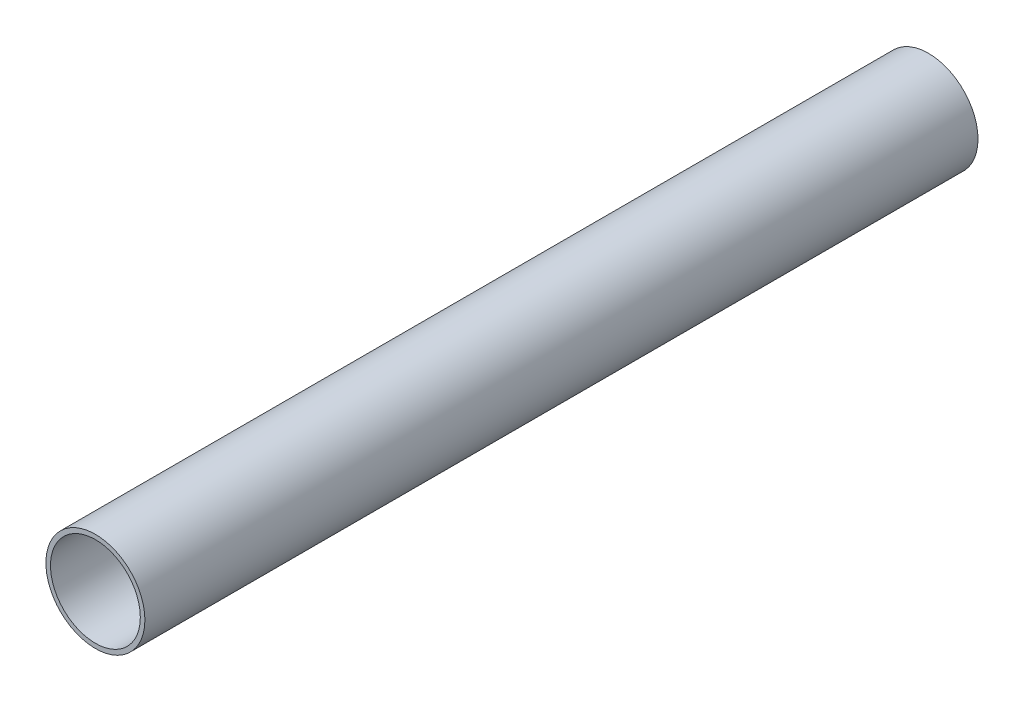
from build123d import *

# Parameters (mm, degrees)
ESQUISSE1_R             = 19.2405
ESQUISSE1_R_2           = 17.4625
BOSS_EXTRU_1_DEPTH      = 914.4
ENL_V_START             = -63.5
ESQUISSE3_R             = 19.2405
ENL_V_MAT_EXTRU_1_DEPTH = 63.5
ENL_V_START_2           = -527.05
ESQUISSE4_R             = 19.2405
ENL_V_MAT_EXTRU_2_DEPTH = 527.05


with BuildPart() as part:
    # Esquisse1 → Boss.-Extru.1 (new body)
    with BuildSketch(Plane.XY):
        Circle(ESQUISSE1_R)
        Circle(ESQUISSE1_R_2, mode=Mode.SUBTRACT)
    extrude(amount=BOSS_EXTRU_1_DEPTH)

    # Esquisse3 → Enlèv. mat.-Extru.1 (cut)
    with BuildSketch(Plane.XY.offset(914.4).offset(ENL_V_START)):
        Circle(ESQUISSE3_R)
    extrude(amount=ENL_V_MAT_EXTRU_1_DEPTH, mode=Mode.SUBTRACT)

    # Esquisse4 → Enlèv. mat.-Extru.2 (cut)
    with BuildSketch(Plane.XY.offset(850.9).offset(ENL_V_START_2)):
        Circle(ESQUISSE4_R)
    extrude(amount=ENL_V_MAT_EXTRU_2_DEPTH, mode=Mode.SUBTRACT)


solid = part.part
